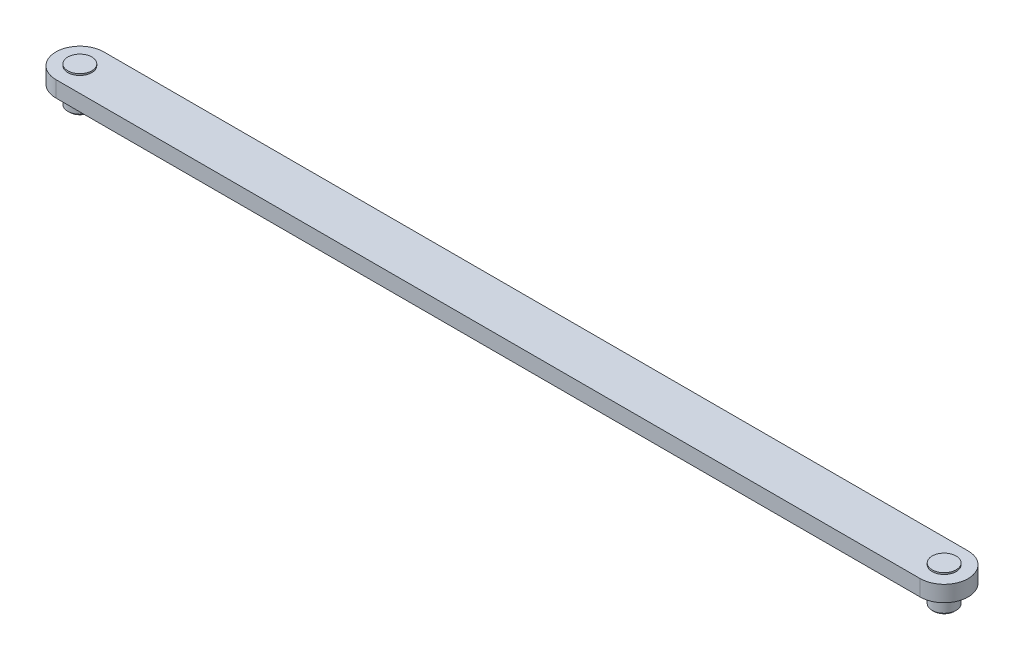
from build123d import *

# Parameters (mm, degrees)
SKETCH2_R                = 7.5
BOSS_EXTRUDE4_DEPTH      = 5
BOSS_EXTRUDE5_DEPTH      = 1
BOSS_EXTRUDE5_DEPTH_BACK = 22
SKETCH5_R                = 7.5
CHAMFER1_SIZE            = 1
BOSS_EXTRUDE8_DEPTH      = 1
BOSS_EXTRUDE8_DEPTH_BACK = 22
SKETCH8_R                = 7.5
CHAMFER3_SIZE            = 1


with BuildPart() as part:
    # Sketch2 → Boss-Extrude4 (new, symmetric)
    with BuildSketch(Plane(origin=(0, 0, 0), x_dir=(1, 0, 0), z_dir=(0, 1, 0))):
        with BuildLine():
            Line((-141.647927202, 154.020874391), (399.122072798, 154.020874391))
            ThreePointArc((399.122072798, 154.020874391), (414.122072798, 139.020874391), (399.122072798, 124.020874391))
            Line((399.122072798, 124.020874391), (-141.647927202, 124.020874391))
            ThreePointArc((-141.647927202, 124.020874391), (-156.647927202, 139.020874391), (-141.647927202, 154.020874391))
        make_face()
        with Locations(Location((-141.647927202, 139.020874391, 0), (0, 0, 270))):
            Circle(SKETCH2_R, mode=Mode.SUBTRACT)
        with Locations(Location((399.122072798, 139.020874391, 0), (0, 0, 270))):
            Circle(SKETCH2_R, mode=Mode.SUBTRACT)
    extrude(amount=BOSS_EXTRUDE4_DEPTH, both=True)

    # Sketch5 → Boss-Extrude5 (add, two sides: drawn at the far end of the back side and taken through both)
    with BuildSketch(Plane(origin=(0, 5, 0), x_dir=(1, 0, 0), z_dir=(0, 1, 0)).offset(-BOSS_EXTRUDE5_DEPTH_BACK)):
        with Locations(Location((-141.647927202, 139.020874391, 0), (0, 0, 270))):
            Circle(SKETCH5_R)
    extrude(amount=BOSS_EXTRUDE5_DEPTH + BOSS_EXTRUDE5_DEPTH_BACK)

    # Chamfer1
    chamfer1_edges = [part.edges().sort_by_distance(p)[0] for p in [
        (-141.647927202, -17, -146.520874391),
    ]]
    chamfer(chamfer1_edges, length=CHAMFER1_SIZE)

    # Sketch8 → Boss-Extrude8 (add, two sides: drawn at the far end of the back side and taken through both)
    with BuildSketch(Plane(origin=(0, 5, 0), x_dir=(1, 0, 0), z_dir=(0, 1, 0)).offset(-BOSS_EXTRUDE8_DEPTH_BACK)):
        with Locations(Location((399.122072798, 139.020874391, 0), (0, 0, 270))):
            Circle(SKETCH8_R)
    extrude(amount=BOSS_EXTRUDE8_DEPTH + BOSS_EXTRUDE8_DEPTH_BACK)

    # Chamfer3
    chamfer3_edges = [part.edges().sort_by_distance(p)[0] for p in [
        (399.122072798, -17, -146.520874391),
    ]]
    chamfer(chamfer3_edges, length=CHAMFER3_SIZE)


solid = part.part
